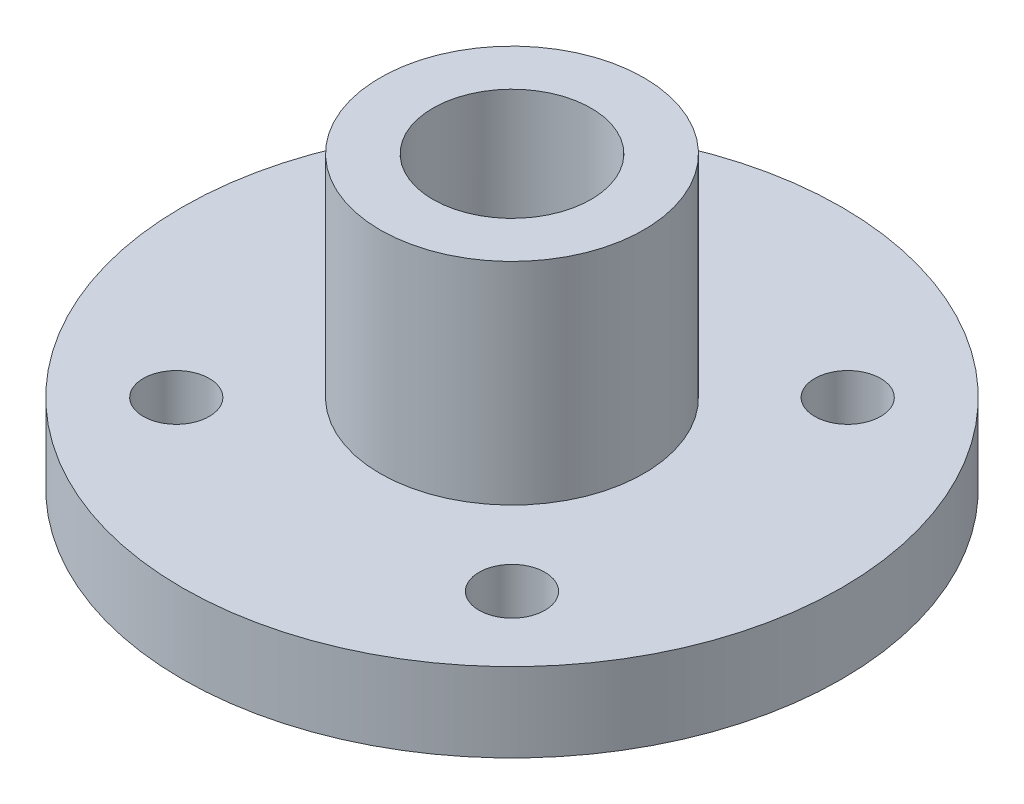
from build123d import *

# Parameters (mm, degrees)
CROQUIS1_R              = 12.5
CROQUIS1_R_2            = 1.25
SALIENTE_EXTRUIR1_DEPTH = 3
SALIENTE_EXTRUIR2_START = 3
CROQUIS1_3_R            = 5
CROQUIS1_3_R_2          = 3
SALIENTE_EXTRUIR2_DEPTH = 8
CROQUIS2_R              = 1.5
CORTAR_EXTRUIR1_DEPTH   = 21.820662814


with BuildPart() as part:
    # Croquis1 → Saliente-Extruir1 (new body)
    with BuildSketch(Plane(origin=(0, 0, 0), x_dir=(1, 0, 0), z_dir=(0, 1, 0))):
        with Locations(Location((0, 0, 0), (0, 0, 270))):
            Circle(CROQUIS1_R)
        with Locations(Location((-6.363961031, 6.363961031, 0), (0, 0, 270))):
            Circle(CROQUIS1_R_2, mode=Mode.SUBTRACT)
        with Locations(Location((6.363961031, 6.363961031, 0), (0, 0, 270))):
            Circle(CROQUIS1_R_2, mode=Mode.SUBTRACT)
        with Locations(Location((6.363961031, -6.363961031, 0), (0, 0, 270))):
            Circle(CROQUIS1_R_2, mode=Mode.SUBTRACT)
        with Locations(Location((-6.363961031, -6.363961031, 0), (0, 0, 270))):
            Circle(CROQUIS1_R_2, mode=Mode.SUBTRACT)
    extrude(amount=SALIENTE_EXTRUIR1_DEPTH)

    # Croquis1<3> → Saliente-Extruir2 (add)
    with BuildSketch(Plane(origin=(0, 0, 0), x_dir=(1, 0, 0), z_dir=(0, 1, 0)).offset(SALIENTE_EXTRUIR2_START)):
        with Locations(Location((0, 0, 0), (0, 0, 270))):
            Circle(CROQUIS1_3_R)
        with Locations(Location((0, 0, 0), (0, 0, 270))):
            Circle(CROQUIS1_3_R_2, mode=Mode.SUBTRACT)
    extrude(amount=SALIENTE_EXTRUIR2_DEPTH)

    # Croquis2 → Cortar-Extruir1 (cut, through all)
    with BuildSketch(Plane(origin=(0, 0, 0), x_dir=(0, 0, -1), z_dir=(1, 0, 0))):
        with Locations((0, 6)):
            Circle(CROQUIS2_R)
    extrude(amount=-CORTAR_EXTRUIR1_DEPTH, mode=Mode.SUBTRACT)


solid = part.part
